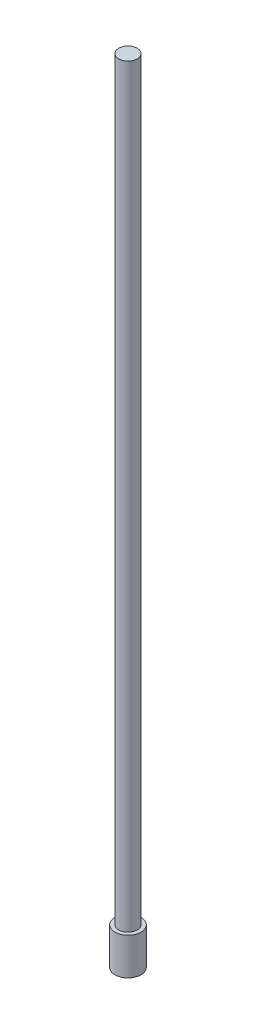
from build123d import *

# Parameters (mm, degrees)
SKETCH1_R           = 3.5
SKETCH1_R_2         = 2.5
BOSS_EXTRUDE1_DEPTH = 10
SKETCH2_R           = 2.5
BOSS_EXTRUDE2_DEPTH = 3.75
SKETCH3_R           = 2.5
BOSS_EXTRUDE3_DEPTH = 200


with BuildPart() as part:
    # Sketch1 → Boss-Extrude1 (new body)
    with BuildSketch(Plane(origin=(0, 0, 0), x_dir=(1, 0, 0), z_dir=(0, 1, 0))):
        with Locations(Location((0, 0, 0), (0, 0, 270))):
            Circle(SKETCH1_R)
        with Locations(Location((0, 0, 0), (0, 0, 270))):
            Circle(SKETCH1_R_2, mode=Mode.SUBTRACT)
    extrude(amount=BOSS_EXTRUDE1_DEPTH)

    # Sketch2 → Boss-Extrude2 (add, symmetric)
    with BuildSketch(Plane(origin=(0, 10, 0), x_dir=(1, 0, 0), z_dir=(0, 1, 0))):
        with Locations(Location((0, 0, 0), (0, 0, 270))):
            Circle(SKETCH2_R)
    extrude(amount=BOSS_EXTRUDE2_DEPTH, both=True)

    # Sketch3 → Boss-Extrude3 (add)
    with BuildSketch(Plane(origin=(0, 13.75, 0), x_dir=(1, 0, 0), z_dir=(0, 1, 0))):
        with Locations(Location((0, 0, 0), (0, 0, 270))):
            Circle(SKETCH3_R)
    extrude(amount=BOSS_EXTRUDE3_DEPTH)


solid = part.part
